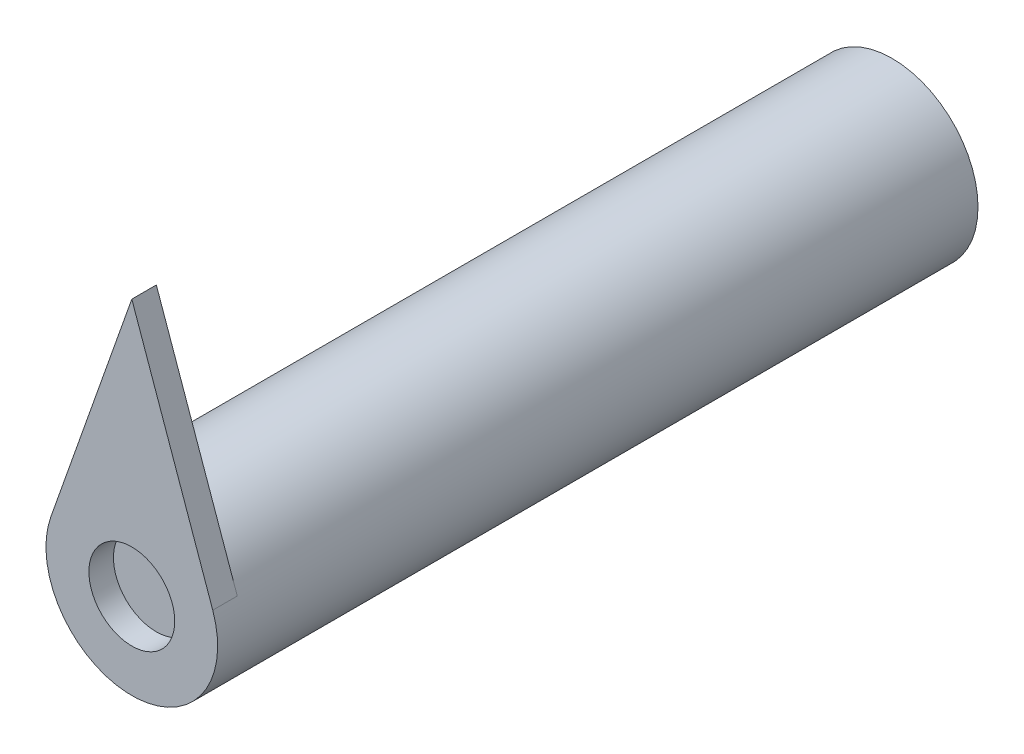
from build123d import *

# Parameters (mm, degrees)
SKETCH1_R           = 3.5
BOSS_EXTRUDE1_DEPTH = 30
SKETCH3_R           = 1.75
BOSS_EXTRUDE2_DEPTH = 1


with BuildPart() as part:
    # Sketch1 → Boss-Extrude1 (new body)
    with BuildSketch(Plane.XY):
        Circle(SKETCH1_R)
    extrude(amount=BOSS_EXTRUDE1_DEPTH)

    # Sketch3 → Boss-Extrude2 (add)
    with BuildSketch(Plane.XY.offset(30)):
        with BuildLine():
            Line((0, 10.5), (-3.299831646, 1.166666667))
            ThreePointArc((-3.299831646, 1.166666667), (0, -3.5), (3.299831646, 1.166666667))
            Line((3.299831646, 1.166666667), (0, 10.5))
        make_face()
        Circle(SKETCH3_R, mode=Mode.SUBTRACT)
    extrude(amount=BOSS_EXTRUDE2_DEPTH)


solid = part.part
